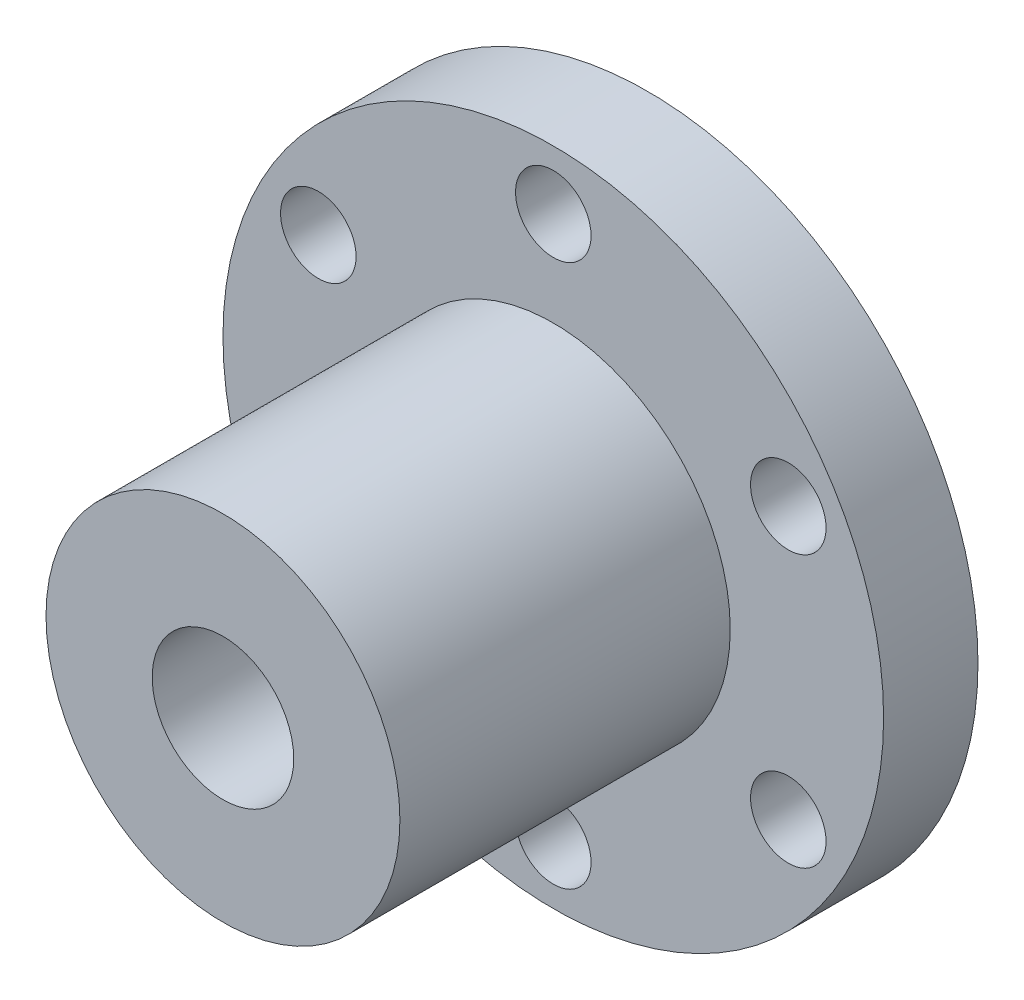
from build123d import *

# Parameters (mm, degrees)
SKETCH_1_R          = 14
EXTRUDE_1_DEPTH     = 4
SKETCH_2_R          = 7.5
EXTRUDE_2_DEPTH     = 14
CUT_EXTRUDE_1_REACH = 28.758
SKETCH_3_R          = 3
CUT_EXTRUDE_2_REACH = 26.249
SKETCH_4_R          = 1.6


with BuildPart() as part:
    # 草图1 → 凸台-拉伸1 (new body)
    with BuildSketch(Plane.XY):
        Circle(SKETCH_1_R)
    extrude(amount=EXTRUDE_1_DEPTH)

    # 草图2 → 凸台-拉伸2 (add)
    with BuildSketch(Plane.XY.offset(4)):
        Circle(SKETCH_2_R)
    extrude(amount=EXTRUDE_2_DEPTH)

    # 草图3 → 切除-拉伸1 (cut, up to next)
    with BuildSketch(Plane.XY.offset(18), mode=Mode.PRIVATE) as cut_extrude_1_sk1:
        Circle(SKETCH_3_R)
    cut_extrude_1_tool1 = extrude(cut_extrude_1_sk1.sketch, amount=-CUT_EXTRUDE_1_REACH, mode=Mode.PRIVATE) & part.part
    add(cut_extrude_1_tool1.solids().sort_by_distance((0, 0, 18))[0], mode=Mode.SUBTRACT)

    # 草图4 → 切除-拉伸2 (cut, up to next)
    with BuildSketch(Plane.XY.offset(4), mode=Mode.PRIVATE) as cut_extrude_2_sk1:
        with Locations((0, 11.5)):
            Circle(SKETCH_4_R)
    cut_extrude_2_tool1 = extrude(cut_extrude_2_sk1.sketch, amount=-CUT_EXTRUDE_2_REACH, mode=Mode.PRIVATE) & part.part
    # 草图4 → 切除-拉伸2 (cut, up to next)
    with BuildSketch(Plane.XY.offset(4), mode=Mode.PRIVATE) as cut_extrude_2_sk2:
        with Locations((9.959292144, 5.75)):
            Circle(SKETCH_4_R)
    cut_extrude_2_tool2 = extrude(cut_extrude_2_sk2.sketch, amount=-CUT_EXTRUDE_2_REACH, mode=Mode.PRIVATE) & part.part
    # 草图4 → 切除-拉伸2 (cut, up to next)
    with BuildSketch(Plane.XY.offset(4), mode=Mode.PRIVATE) as cut_extrude_2_sk3:
        with Locations((9.959292144, -5.75)):
            Circle(SKETCH_4_R)
    cut_extrude_2_tool3 = extrude(cut_extrude_2_sk3.sketch, amount=-CUT_EXTRUDE_2_REACH, mode=Mode.PRIVATE) & part.part
    # 草图4 → 切除-拉伸2 (cut, up to next)
    with BuildSketch(Plane.XY.offset(4), mode=Mode.PRIVATE) as cut_extrude_2_sk4:
        with Locations((0, -11.5)):
            Circle(SKETCH_4_R)
    cut_extrude_2_tool4 = extrude(cut_extrude_2_sk4.sketch, amount=-CUT_EXTRUDE_2_REACH, mode=Mode.PRIVATE) & part.part
    # 草图4 → 切除-拉伸2 (cut, up to next)
    with BuildSketch(Plane.XY.offset(4), mode=Mode.PRIVATE) as cut_extrude_2_sk5:
        with Locations((-9.959292144, -5.75)):
            Circle(SKETCH_4_R)
    cut_extrude_2_tool5 = extrude(cut_extrude_2_sk5.sketch, amount=-CUT_EXTRUDE_2_REACH, mode=Mode.PRIVATE) & part.part
    # 草图4 → 切除-拉伸2 (cut, up to next)
    with BuildSketch(Plane.XY.offset(4), mode=Mode.PRIVATE) as cut_extrude_2_sk6:
        with Locations((-9.959292144, 5.75)):
            Circle(SKETCH_4_R)
    cut_extrude_2_tool6 = extrude(cut_extrude_2_sk6.sketch, amount=-CUT_EXTRUDE_2_REACH, mode=Mode.PRIVATE) & part.part
    add(cut_extrude_2_tool1.solids().sort_by_distance((0, 11.5, 4))[0], mode=Mode.SUBTRACT)
    add(cut_extrude_2_tool2.solids().sort_by_distance((9.959292, 5.75, 4))[0], mode=Mode.SUBTRACT)
    add(cut_extrude_2_tool3.solids().sort_by_distance((9.959292, -5.75, 4))[0], mode=Mode.SUBTRACT)
    add(cut_extrude_2_tool4.solids().sort_by_distance((0, -11.5, 4))[0], mode=Mode.SUBTRACT)
    add(cut_extrude_2_tool5.solids().sort_by_distance((-9.959292, -5.75, 4))[0], mode=Mode.SUBTRACT)
    add(cut_extrude_2_tool6.solids().sort_by_distance((-9.959292, 5.75, 4))[0], mode=Mode.SUBTRACT)


solid = part.part
